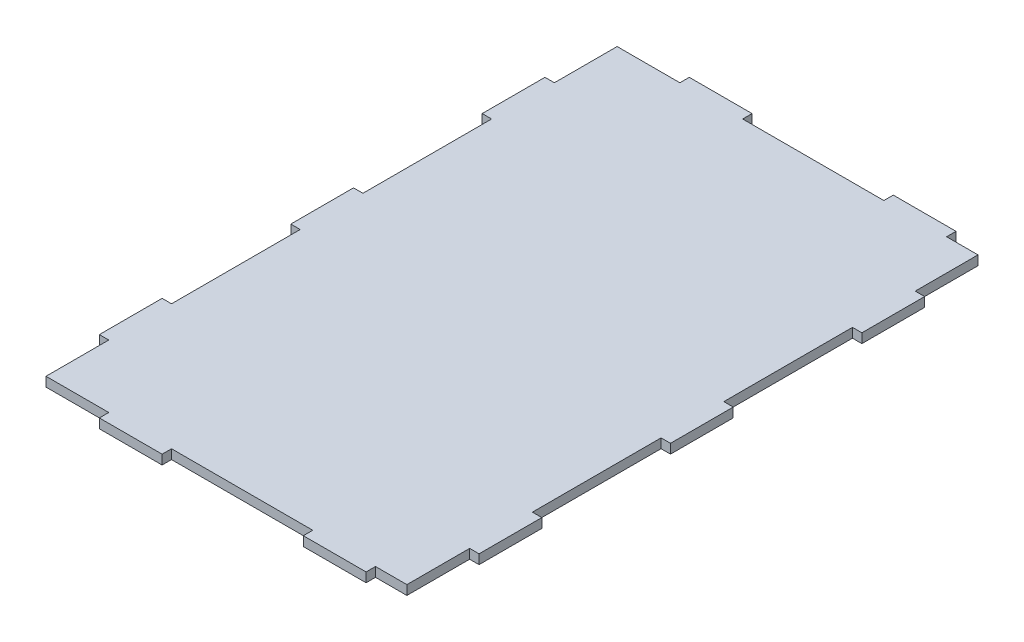
from build123d import *

# Parameters (mm, degrees)
BOSS_EXTRUDE1_DEPTH = 3


with BuildPart() as part:
    # Sketch1 → Boss-Extrude1 (new body)
    with BuildSketch(Plane(origin=(0, 0, 0), x_dir=(1, 0, 0), z_dir=(0, 1, 0))):
        Polygon((40, 0), (85, 0), (85, -3), (105, -3), (105, 0), (115, 0), (115, 20), (118, 20), (118, 40), (115, 40), (115, 81), (118, 81), (118, 101), (115, 101), (115, 142), (118, 142), (118, 162), (115, 162), (115, 182), (105, 182), (105, 185), (85, 185), (85, 182), (40, 182), (40, 185), (20, 185), (20, 182), (0, 182), (0, 162), (-3, 162), (-3, 142), (0, 142), (0, 101), (-3, 101), (-3, 81), (0, 81), (0, 40), (-3, 40), (-3, 20), (0, 20), (0, 0), (20, 0), (20, -3), (40, -3), align=None)
    extrude(amount=BOSS_EXTRUDE1_DEPTH)


solid = part.part
